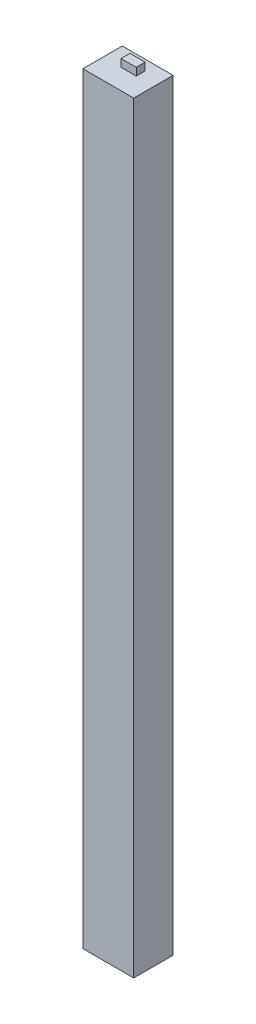
from build123d import *

# Parameters (mm, degrees)
SKETCH_1_W        = 20
SKETCH_1_H        = 300
EXTRUDE_231_DEPTH = 15.5
SKETCH_2_W        = 6
SKETCH_2_H        = 3.5
EXTRUDE_469_DEPTH = 3


with BuildPart() as part:
    # 草图1 → Extrude 231 (new body)
    with BuildSketch(Plane.XY):
        Rectangle(SKETCH_1_W, SKETCH_1_H)
    extrude(amount=EXTRUDE_231_DEPTH)

    # 草图2 → Extrude 469 (add)
    with BuildSketch(Plane(origin=(0, 150, 0), x_dir=(1, 0, 0), z_dir=(0, 1, 0))):
        with Locations((0, -5.75)):
            Rectangle(SKETCH_2_W, SKETCH_2_H)
    extrude(amount=EXTRUDE_469_DEPTH)


solid = part.part
